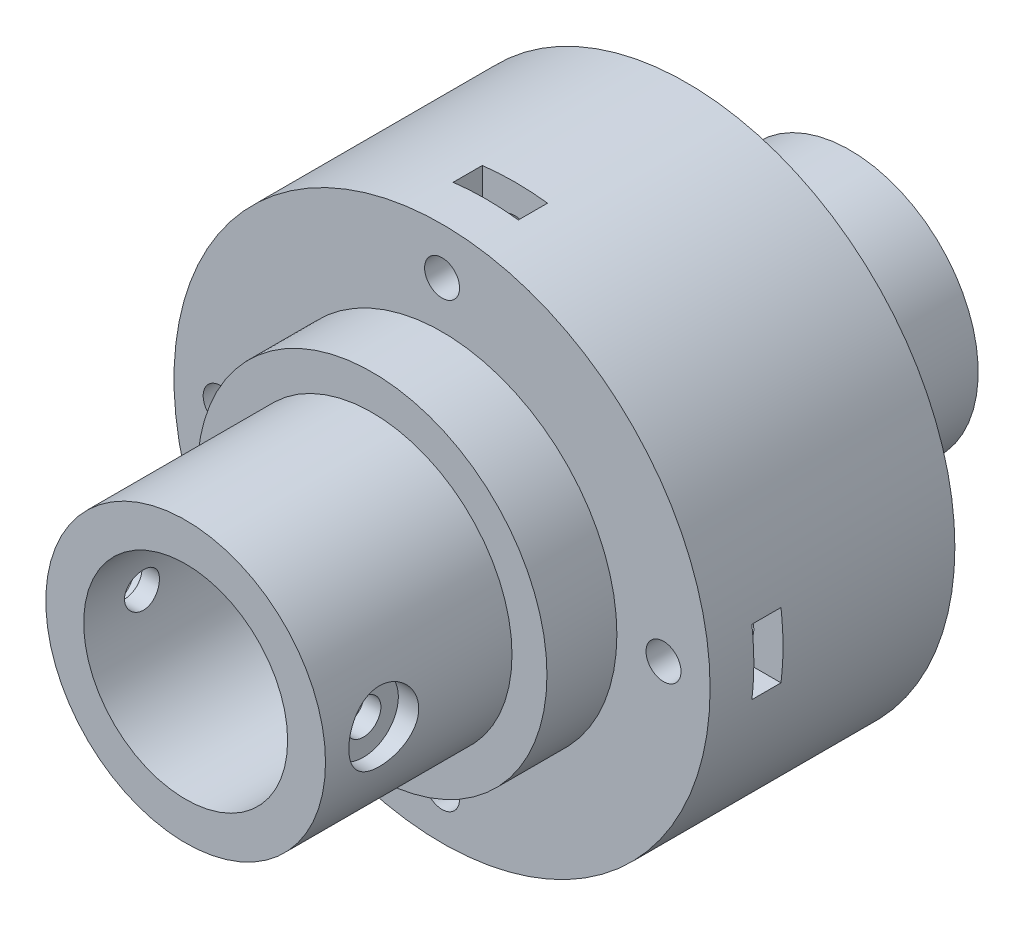
from build123d import *

# Parameters (mm, degrees)
BOSS_EXTRUDE1_DEPTH      = 11
BOSS_EXTRUDE1_DEPTH_BACK = 5
SKETCH1_R                = 15
SKETCH1_R_2              = 13
BOSS_EXTRUDE2_DEPTH      = 5
BOSS_EXTRUDE2_DEPTH_BACK = 10
SKETCH2_R                = 23
SKETCH2_R_2              = 8.75
SKETCH6_R                = 1.5
CUT_EXTRUDE1_DEPTH       = 23
CUT_EXTRUDE2_DEPTH       = 1.25
CUT_EXTRUDE2_DEPTH_BACK  = 1.25
SKETCH13_R               = 13
SKETCH13_R_2             = 8.75
BOSS_EXTRUDE5_DEPTH      = 6
SKETCH14_R               = 12
SKETCH14_R_2             = 8.75
BOSS_EXTRUDE6_DEPTH      = 16
BOSS_EXTRUDE7_START      = 20
SKETCH17_R               = 11
SKETCH17_R_2             = 8.75
BOSS_EXTRUDE7_DEPTH      = 20
CUT_EXTRUDE3_DEPTH       = 57
CUT_EXTRUDE3_DEPTH_BACK  = 57
SKETCH18_R               = 1.5
SKETCH19_R               = 3
CUT_EXTRUDE4_DEPTH       = 14
BOSS_EXTRUDE8_START      = 6
SKETCH20_R               = 23
SKETCH20_R_2             = 11
BOSS_EXTRUDE8_DEPTH      = 6


with BuildPart() as part:
    # Sketch1 → Boss-Extrude1 (new, two sides: drawn at the far end of the back side and taken through both)
    with BuildSketch(Plane.XY.offset(-BOSS_EXTRUDE1_DEPTH_BACK)):
        Circle(SKETCH1_R)
        Circle(SKETCH1_R_2, mode=Mode.SUBTRACT)
    extrude(amount=BOSS_EXTRUDE1_DEPTH + BOSS_EXTRUDE1_DEPTH_BACK)

    # Sketch2 → Boss-Extrude2 (add, two sides: drawn at the far end of the back side and taken through both)
    with BuildSketch(Plane.XY.offset(-BOSS_EXTRUDE2_DEPTH_BACK)):
        Circle(SKETCH2_R)
        Circle(SKETCH2_R_2, mode=Mode.SUBTRACT)
    extrude(amount=BOSS_EXTRUDE2_DEPTH + BOSS_EXTRUDE2_DEPTH_BACK)

    # Sketch6 → Cut-Extrude1 (cut)
    with BuildSketch(Plane.XY.offset(5)):
        with Locations((0, 19)):
            Circle(SKETCH6_R)
        with Locations((19, 0)):
            Circle(SKETCH6_R)
        with Locations((0, -19)):
            Circle(SKETCH6_R)
        with Locations((-19, 0)):
            Circle(SKETCH6_R)
    extrude(amount=-CUT_EXTRUDE1_DEPTH, mode=Mode.SUBTRACT)

    # Sketch9 → Cut-Extrude2 (cut, two sides: drawn at the far end of the back side and taken through both)
    with BuildSketch(Plane.XY.offset(-CUT_EXTRUDE2_DEPTH_BACK)):
        Polygon((-2.8, 20.616580754), (-2.8, 26.448707706), (2.8, 26.448707706), (2.8, 20.616580754), (2.8, 17.383419246), (0, 15.766838493), (-2.8, 17.383419246), align=None)
        Polygon((20.616580754, 2.8), (26.448707706, 2.8), (26.448707706, -2.8), (20.616580754, -2.8), (17.383419246, -2.8), (15.766838493, 0), (17.383419246, 2.8), align=None)
        Polygon((2.8, -20.616580754), (2.8, -26.448707706), (-2.8, -26.448707706), (-2.8, -20.616580754), (-2.8, -17.383419246), (0, -15.766838493), (2.8, -17.383419246), align=None)
        Polygon((-20.616580754, -2.8), (-26.448707706, -2.8), (-26.448707706, 2.8), (-20.616580754, 2.8), (-17.383419246, 2.8), (-15.766838493, 0), (-17.383419246, -2.8), align=None)
    extrude(amount=CUT_EXTRUDE2_DEPTH + CUT_EXTRUDE2_DEPTH_BACK, mode=Mode.SUBTRACT)

    # Sketch13 → Boss-Extrude5 (add)
    with BuildSketch(Plane.XY.offset(5)):
        Circle(SKETCH13_R)
        Circle(SKETCH13_R_2, mode=Mode.SUBTRACT)
    extrude(amount=BOSS_EXTRUDE5_DEPTH)

    # Sketch14 → Boss-Extrude6 (add)
    with BuildSketch(Plane.XY.offset(11)):
        Circle(SKETCH14_R)
        Circle(SKETCH14_R_2, mode=Mode.SUBTRACT)
    extrude(amount=BOSS_EXTRUDE6_DEPTH)

    # Sketch17 → Boss-Extrude7 (add)
    with BuildSketch(Plane(origin=(0, 0, -10), x_dir=(-1, 0, 0), z_dir=(0, 0, -1)).offset(BOSS_EXTRUDE7_START)):
        with Locations(Location((0, 0, 0), (0, 0, 180))):
            Circle(SKETCH17_R)
        with Locations(Location((0, 0, 0), (0, 0, 180))):
            Circle(SKETCH17_R_2, mode=Mode.SUBTRACT)
    extrude(amount=-BOSS_EXTRUDE7_DEPTH)

    # Sketch18 → Cut-Extrude3 (cut, two sides: drawn at the far end of the back side and taken through both)
    with BuildSketch(Plane(origin=(0, 0, 0), x_dir=(0, 0, -1), z_dir=(1, 0, 0)).offset(-CUT_EXTRUDE3_DEPTH_BACK)):
        with Locations(Location((-22, 0, 0), (0, 0, 180))):
            Circle(SKETCH18_R)
    extrude(amount=CUT_EXTRUDE3_DEPTH + CUT_EXTRUDE3_DEPTH_BACK, mode=Mode.SUBTRACT)

    # Sketch19 → Cut-Extrude4 (cut)
    with BuildSketch(Plane(origin=(10.25, 0, 0), x_dir=(0, 0, -1), z_dir=(1, 0, 0))):
        with Locations((-22, 0)):
            Circle(SKETCH19_R)
    cut_extrude4 = extrude(amount=CUT_EXTRUDE4_DEPTH, mode=Mode.SUBTRACT)

    # Mirror1: Cut-Extrude4 across plane
    add(cut_extrude4.mirror(Plane(origin=(0, 0, 0), x_dir=(0, 0, 1), z_dir=(1, 0, 0))), mode=Mode.SUBTRACT)

    # Sketch20 → Boss-Extrude8 (add)
    with BuildSketch(Plane(origin=(0, 0, -10), x_dir=(-1, 0, 0), z_dir=(0, 0, -1)).offset(BOSS_EXTRUDE8_START)):
        with Locations(Location((0, 0, 0), (0, 0, 180))):
            Circle(SKETCH20_R)
        Circle(SKETCH20_R_2, mode=Mode.SUBTRACT)
    extrude(amount=-BOSS_EXTRUDE8_DEPTH)


solid = part.part
